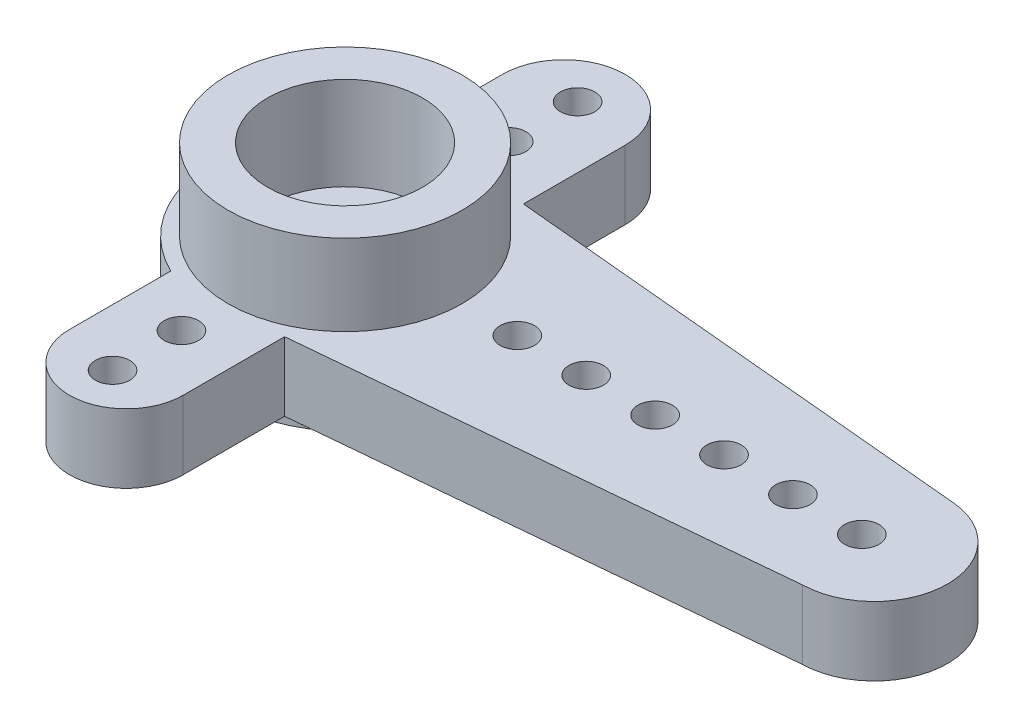
from build123d import *

# Parameters (mm, degrees)
SKETCH_1_R      = 3.4
SKETCH_1_R_2    = 2.25
EXTRUDE_1_DEPTH = 4.85
EXTRUDE_START   = 0.5
SKETCH_2_R      = 2.25
SKETCH_2_R_2    = 0.5
EXTRUDE_2_DEPTH = 2
EXTRUDE_START_2 = 1.25
SKETCH_3_R      = 2.25
SKETCH_3_R_2    = 1.15
EXTRUDE_3_DEPTH = 0.9


with BuildPart() as part:
    # 草图1 → 凸台-拉伸1 (new body)
    with BuildSketch(Plane(origin=(0, 0, 0), x_dir=(1, 0, 0), z_dir=(0, 1, 0))):
        with Locations(Location((0, 0, 0), (0, 0, 270))):
            Circle(SKETCH_1_R)
        with Locations(Location((0, 0, 0), (0, 0, 270))):
            Circle(SKETCH_1_R_2, mode=Mode.SUBTRACT)
    extrude(amount=EXTRUDE_1_DEPTH)

    # 草图2 → 凸台-拉伸2 (add)
    with BuildSketch(Plane(origin=(0, 0, 0), x_dir=(1, 0, 0), z_dir=(0, 1, 0)).offset(EXTRUDE_START)):
        with BuildLine():
            Line((1.781000011, 3.395903963), (1.781000011, 6.35))
            ThreePointArc((1.781000011, 6.35), (0, 8.13100001), (-1.781000011, 6.35))
            Line((-1.781000011, 6.35), (-1.781000011, 3.342130588))
            ThreePointArc((-1.781000011, 3.342130588), (-3.786362647, -0.072496957), (-1.651758938, -3.407857144))
            Line((-1.651758938, -3.407857144), (-1.651758938, -6.35))
            ThreePointArc((-1.651758938, -6.35), (0, -8.001758939), (1.651758938, -6.35))
            Line((1.651758938, -6.35), (1.651758938, -3.407857144))
            Line((1.651758938, -3.407857144), (15.410111856, -2.130295801))
            ThreePointArc((15.410111856, -2.130295801), (17.490132215, -0.073847388), (15.557558889, 2.121744812))
            Line((15.557558889, 2.121744812), (1.781000011, 3.395903963))
        make_face()
        with Locations(Location((0, 0, 0), (0, 0, 270))):
            Circle(SKETCH_2_R, mode=Mode.SUBTRACT)
        with Locations(Location((0, -6.75, 0), (0, 0, 270))):
            Circle(SKETCH_2_R_2, mode=Mode.SUBTRACT)
        with Locations(Location((0, -4.75, 0), (0, 0, 270))):
            Circle(SKETCH_2_R_2, mode=Mode.SUBTRACT)
        with Locations(Location((15, 0, 0), (0, 0, 270))):
            Circle(SKETCH_2_R_2, mode=Mode.SUBTRACT)
        with Locations(Location((13, 0, 0), (0, 0, 270))):
            Circle(SKETCH_2_R_2, mode=Mode.SUBTRACT)
        with Locations(Location((11, 0, 0), (0, 0, 270))):
            Circle(SKETCH_2_R_2, mode=Mode.SUBTRACT)
        with Locations(Location((9, 0, 0), (0, 0, 270))):
            Circle(SKETCH_2_R_2, mode=Mode.SUBTRACT)
        with Locations(Location((7, 0, 0), (0, 0, 270))):
            Circle(SKETCH_2_R_2, mode=Mode.SUBTRACT)
        with Locations(Location((5, 0, 0), (0, 0, 270))):
            Circle(SKETCH_2_R_2, mode=Mode.SUBTRACT)
        with Locations(Location((0, 6.75, 0), (0, 0, 270))):
            Circle(SKETCH_2_R_2, mode=Mode.SUBTRACT)
        with Locations(Location((0, 4.75, 0), (0, 0, 270))):
            Circle(SKETCH_2_R_2, mode=Mode.SUBTRACT)
    extrude(amount=EXTRUDE_2_DEPTH)

    # 草图3 → 凸台-拉伸3 (add)
    with BuildSketch(Plane(origin=(0, 0, 0), x_dir=(1, 0, 0), z_dir=(0, 1, 0)).offset(EXTRUDE_START_2)):
        with Locations(Location((0, 0, 0), (0, 0, 270))):
            Circle(SKETCH_3_R)
        with Locations(Location((0, 0, 0), (0, 0, 270))):
            Circle(SKETCH_3_R_2, mode=Mode.SUBTRACT)
    extrude(amount=EXTRUDE_3_DEPTH)


solid = part.part
